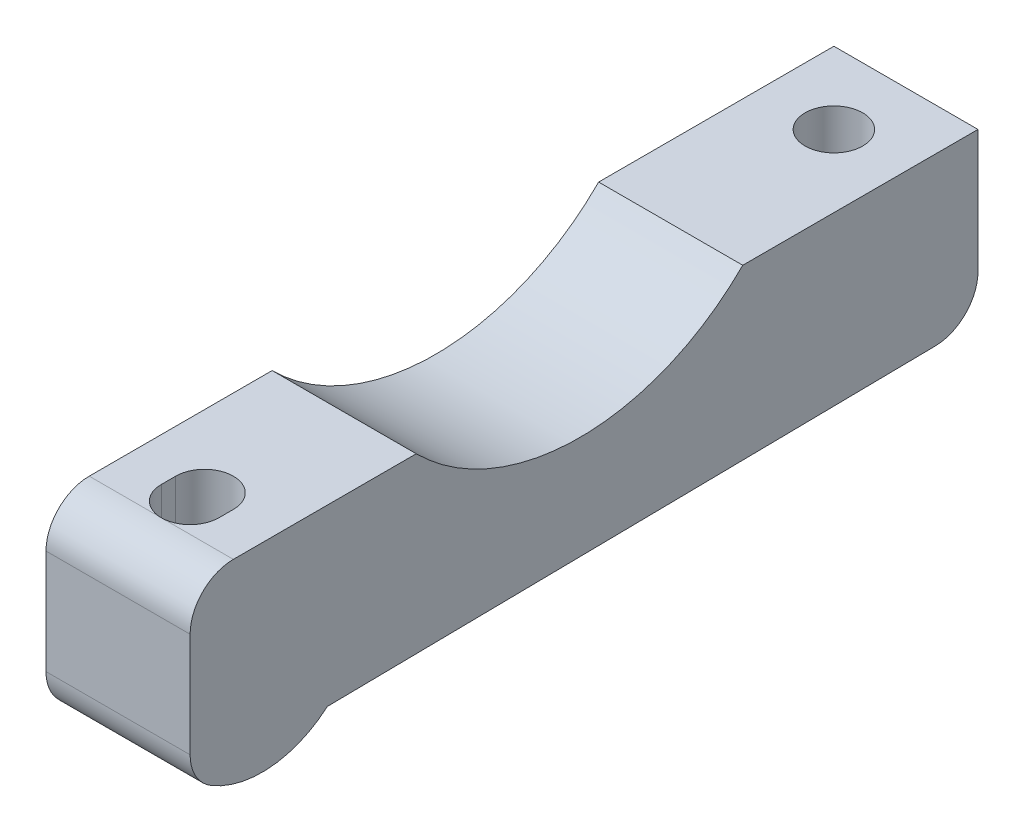
from build123d import *

# Parameters (mm, degrees)
BOSS_EXTRU_1_DEPTH      = 10
ENL_V_MAT_EXTRU_1_DEPTH = 90.16782474
ESQUISSE3_R             = 2
ENL_V_MAT_EXTRU_2_DEPTH = 90.167824766
ENL_V_MAT_EXTRU_3_DEPTH = 3.3
ENL_V_MAT_EXTRU_4_DEPTH = 102.195391925


with BuildPart() as part:
    # Esquisse1 → Boss.-Extru.1 (new body)
    with BuildSketch(Plane(origin=(0, 0, 0), x_dir=(0, 0, -1), z_dir=(1, 0, 0))):
        with BuildLine():
            Line((-87.523995303, -46.245048312), (-87.523995303, -38.999770184))
            ThreePointArc((-87.523995303, -38.999770184), (-86.645315647, -36.87844984), (-84.523995303, -35.999770184))
            Line((-84.523995303, -35.999770184), (-70.36921968, -35.999770184))
            ThreePointArc((-70.36921968, -35.999770184), (-60.503302019, -39.700935345), (-50.637384358, -35.999770184))
            Line((-50.637384358, -35.999770184), (-32.848182024, -35.999770184))
            Line((-32.848182024, -35.999770184), (-32.848182024, -44.534320741))
            ThreePointArc((-32.848182024, -44.534320741), (-33.712584856, -46.641267521), (-35.80766518, -47.534047126))
            Line((-35.80766518, -47.534047126), (-78.000260647, -48.103936043))
            ThreePointArc((-78.000260647, -48.103936043), (-81.919367341, -49.773558375), (-86.070253365, -48.815862581))
            ThreePointArc((-86.070253365, -48.815862581), (-87.135390925, -47.72173816), (-87.523995303, -46.245048312))
        make_face()
    extrude(amount=BOSS_EXTRU_1_DEPTH)

    # Esquisse2 → Enlèv. mat.-Extru.1 (cut, through all)
    with BuildSketch(Plane(origin=(0, -35.999770184, 0), x_dir=(1, 0, 0), z_dir=(0, 1, 0))):
        with BuildLine():
            Line((3, -82.523995303), (3, -81.523995303))
            ThreePointArc((3, -81.523995303), (5, -79.523995303), (7, -81.523995303))
            Line((7, -81.523995303), (7, -82.523995303))
            ThreePointArc((7, -82.523995303), (5, -84.523995303), (3, -82.523995303))
        make_face()
    extrude(amount=-ENL_V_MAT_EXTRU_1_DEPTH, mode=Mode.SUBTRACT)

    # Esquisse3 → Enlèv. mat.-Extru.2 (cut, through all)
    with BuildSketch(Plane(origin=(0, -35.999770184, 0), x_dir=(1, 0, 0), z_dir=(0, 1, 0))):
        with Locations(Location((5, -37.848182024, 0), (0, 0, 270))):
            Circle(ESQUISSE3_R)
    extrude(amount=-ENL_V_MAT_EXTRU_2_DEPTH, mode=Mode.SUBTRACT)

    # Esquisse4 → Enlèv. mat.-Extru.3 (cut)
    with BuildSketch(Plane(origin=(0, -47.999770184, 141.218220364), x_dir=(1, 0, 0), z_dir=(0, 1, 0))):
        Polygon((5, 107.552964167), (1.377479972, 105.461501254), (1.377479972, 101.278575427), (5, 99.187112513), (8.622520028, 101.278575427), (8.622520028, 105.461501254), align=None)
    extrude(amount=ENL_V_MAT_EXTRU_3_DEPTH, mode=Mode.SUBTRACT)

    # Esquisse5 → Enlèv. mat.-Extru.4 (cut, through all)
    with BuildSketch(Plane(origin=(10, 0, 0), x_dir=(0, 0, -1), z_dir=(1, 0, 0))):
        with BuildLine():
            Line((-70.36921968, -35.999770184), (-71.83186465, -35.999770184))
            ThreePointArc((-71.83186465, -35.999770184), (-60.503302019, -40.700935345), (-49.174739388, -35.999770184))
            Line((-49.174739388, -35.999770184), (-50.637384358, -35.999770184))
            Line((-50.637384358, -35.999770184), (-70.36921968, -35.999770184))
        make_face()
    extrude(amount=-ENL_V_MAT_EXTRU_4_DEPTH, mode=Mode.SUBTRACT)


solid = part.part
